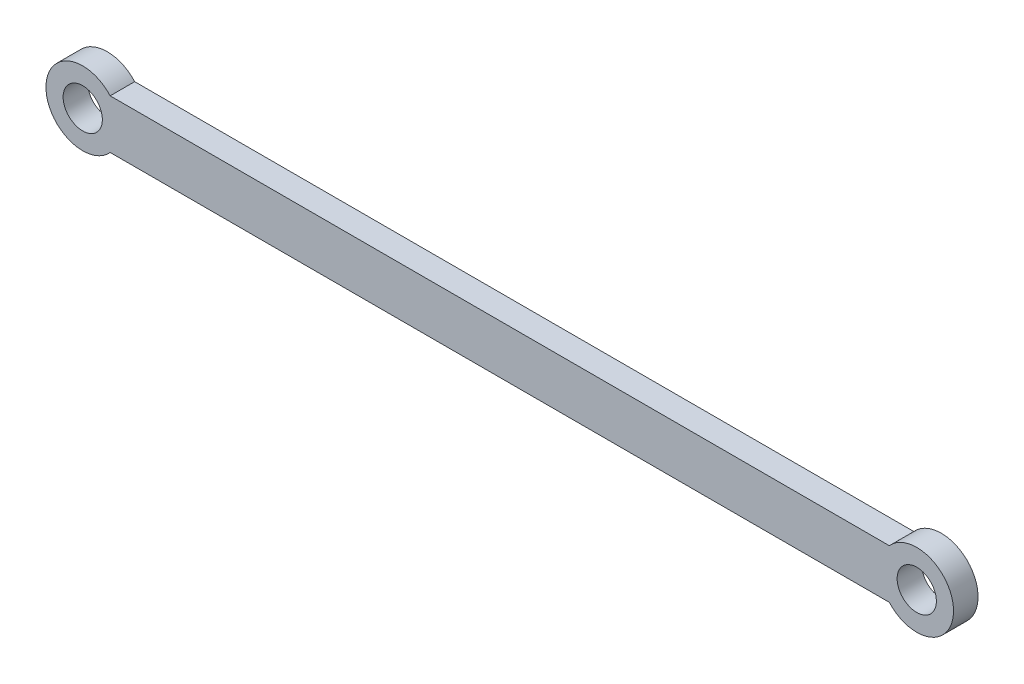
from build123d import *

# Parameters (mm, degrees)
SCHIZZO1_R                   = 4
ESTRUSIONE_ESTRUSIONE1_DEPTH = 5


with BuildPart() as part:
    # Schizzo1 → Estrusione-Estrusione1 (new body)
    with BuildSketch(Plane.XY):
        with BuildLine():
            Line((5.590169944, -5), (164.409830056, -5))
            ThreePointArc((164.409830056, -5), (177.5, 0), (164.409830056, 5))
            Line((164.409830056, 5), (5.590169944, 5))
            ThreePointArc((5.590169944, 5), (-7.5, 0), (5.590169944, -5))
        make_face()
        Circle(SCHIZZO1_R, mode=Mode.SUBTRACT)
        with Locations((170, 0)):
            Circle(SCHIZZO1_R, mode=Mode.SUBTRACT)
    extrude(amount=ESTRUSIONE_ESTRUSIONE1_DEPTH)


solid = part.part
